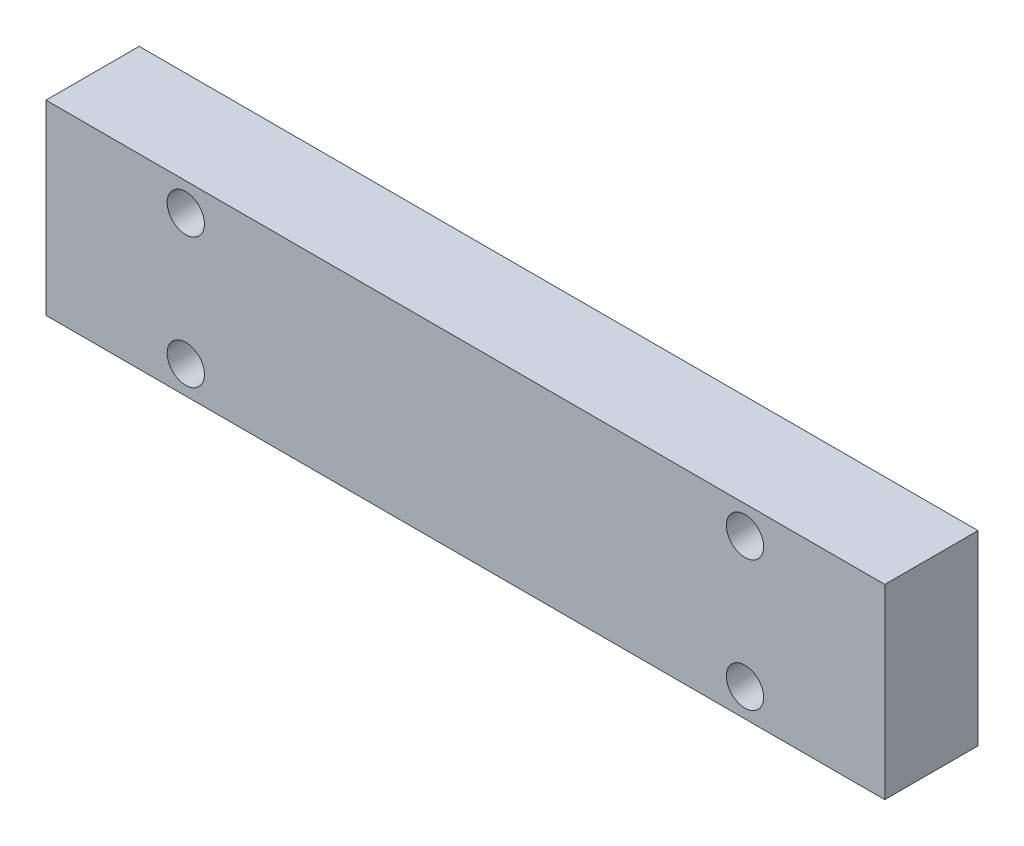
from build123d import *

# Parameters (mm, degrees)
ESQUISSE1_W             = 90
ESQUISSE1_H             = 20
BOSS_EXTRU_1_DEPTH      = 10
ESQUISSE2_R             = 2
ENL_V_MAT_EXTRU_2_DEPTH = 94


with BuildPart() as part:
    # Esquisse1 → Boss.-Extru.1 (new body)
    with BuildSketch(Plane.XY):
        with Locations((-16.284157465, 17.946446701)):
            Rectangle(ESQUISSE1_W, ESQUISSE1_H)
    extrude(amount=BOSS_EXTRU_1_DEPTH)

    # Esquisse2 → Enlèv. mat.-Extru.2 (cut)
    with BuildSketch(Plane(origin=(0, 0, 0), x_dir=(-1, 0, 0), z_dir=(0, 0, -1))):
        with Locations((-13.715842535, 24.946446701)):
            Circle(ESQUISSE2_R)
        with Locations((-13.715842535, 10.946446701)):
            Circle(ESQUISSE2_R)
        with Locations(Location((46.284157465, 10.946446701, 0), (0, 0, 180))):
            Circle(ESQUISSE2_R)
        with Locations(Location((46.284157465, 24.946446701, 0), (0, 0, 180))):
            Circle(ESQUISSE2_R)
    extrude(amount=-ENL_V_MAT_EXTRU_2_DEPTH, mode=Mode.SUBTRACT)


solid = part.part
